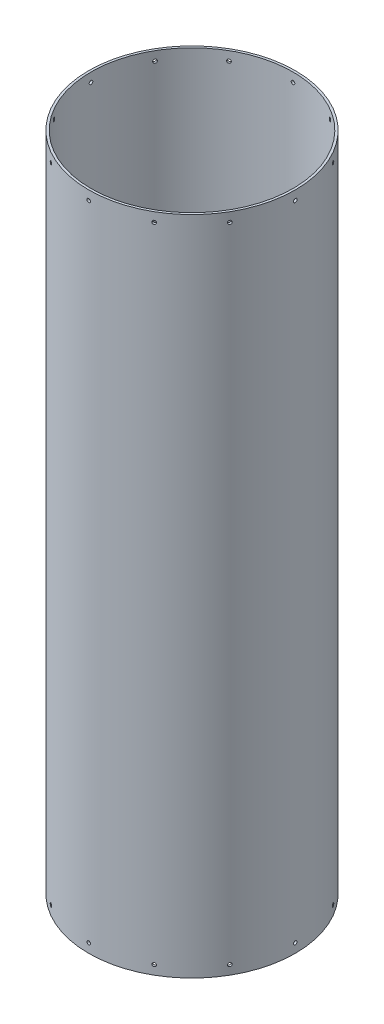
from build123d import *

# Parameters (mm, degrees)
SKETCH1_R                         = 142.875
SKETCH1_R_2                       = 139.7
BOSS_EXTRUDE1_DEPTH               = 914.4
F_10_0_1935_DIAMETER_HOLE1_REACH  = 970.604
F_10_0_1935_DIAMETER_HOLE1_BORE_R = 2.45745
CIRPATTERN1_COUNT                 = 12
MIRROR1_COPY_1_REACH              = 970.604
MIRROR1_COPY_1_SKETCH_R           = 2.45745
MIRROR1_COPY_2_REACH              = 970.604
MIRROR1_COPY_2_SKETCH_R           = 2.45745
MIRROR1_COPY_3_REACH              = 970.604
MIRROR1_COPY_3_SKETCH_R           = 2.45745
MIRROR1_COPY_4_REACH              = 970.604
MIRROR1_COPY_4_SKETCH_R           = 2.45745
MIRROR1_COPY_5_REACH              = 970.604
MIRROR1_COPY_5_SKETCH_R           = 2.45745
MIRROR1_COPY_6_REACH              = 970.604
MIRROR1_COPY_6_SKETCH_R           = 2.45745
MIRROR1_COPY_7_REACH              = 970.604
MIRROR1_COPY_7_SKETCH_R           = 2.45745
MIRROR1_COPY_8_REACH              = 970.604
MIRROR1_COPY_8_SKETCH_R           = 2.45745
MIRROR1_COPY_9_REACH              = 970.604
MIRROR1_COPY_9_SKETCH_R           = 2.45745
MIRROR1_COPY_10_REACH             = 970.604
MIRROR1_COPY_10_SKETCH_R          = 2.45745
MIRROR1_COPY_11_REACH             = 970.604
MIRROR1_COPY_11_SKETCH_R          = 2.45745


with BuildPart() as part:
    # Sketch1 → Boss-Extrude1 (new body)
    with BuildSketch(Plane(origin=(0, 0, 0), x_dir=(1, 0, 0), z_dir=(0, 1, 0))):
        with Locations(Location((0, 0, 0), (0, 0, 270))):
            Circle(SKETCH1_R)
        with Locations(Location((0, 0, 0), (0, 0, 270))):
            Circle(SKETCH1_R_2, mode=Mode.SUBTRACT)
    extrude(amount=BOSS_EXTRUDE1_DEPTH)

    # #10 (0.1935) Diameter Hole1 bore → #10 (0.1935) Diameter Hole1 (cut, up to next)
    with BuildSketch(Plane(origin=(142.875, 0, 0), x_dir=(0, 0, -1), z_dir=(1, 0, 0)), mode=Mode.PRIVATE) as f_10_0_1935_diameter_hole1_sk1:
        with Locations((0, 901.7)):
            Circle(F_10_0_1935_DIAMETER_HOLE1_BORE_R)
    f_10_0_1935_diameter_hole1_tool1 = extrude(f_10_0_1935_diameter_hole1_sk1.sketch, amount=-F_10_0_1935_DIAMETER_HOLE1_REACH, mode=Mode.PRIVATE) & part.part
    f_10_0_1935_diameter_hole1 = f_10_0_1935_diameter_hole1_tool1.solids().sort_by_distance((142.875, 901.7, 0))[0]
    add(f_10_0_1935_diameter_hole1, mode=Mode.SUBTRACT)

    # CirPattern1: #10 (0.1935) Diameter Hole1 ×12 about axis
    cirpattern1_axis = Axis((0, 914.4, 0), (0, 1, 0))
    for i in range(1, CIRPATTERN1_COUNT):
        add(f_10_0_1935_diameter_hole1.rotate(cirpattern1_axis, i * 360 / CIRPATTERN1_COUNT), mode=Mode.SUBTRACT)

    # Mirror1: #10 (0.1935) Diameter Hole1 across plane
    add(f_10_0_1935_diameter_hole1.mirror(Plane.ZX.offset(457.2)), mode=Mode.SUBTRACT)

    # Mirror1 copy 1 sketch → Mirror1 copy 1 (cut, up to next)
    with BuildSketch(Plane(origin=(123.733379566, 914.4, -71.4375), x_dir=(-0.49999999999999994, 0, -0.8660254037844387), z_dir=(0.8660254037844387, 0, -0.49999999999999994)), mode=Mode.PRIVATE) as mirror1_copy_1_sk1:
        with Locations((0, -901.7)):
            Circle(MIRROR1_COPY_1_SKETCH_R)
    mirror1_copy_1_tool1 = extrude(mirror1_copy_1_sk1.sketch, amount=-MIRROR1_COPY_1_REACH, mode=Mode.PRIVATE) & part.part
    add(mirror1_copy_1_tool1.solids().sort_by_distance((123.733379566, 12.7, -71.4375))[0], mode=Mode.SUBTRACT)

    # Mirror1 copy 2 sketch → Mirror1 copy 2 (cut, up to next)
    with BuildSketch(Plane(origin=(71.4375, 914.4, -123.733379566), x_dir=(-0.8660254037844386, 0, -0.5000000000000001), z_dir=(0.5000000000000001, 0, -0.8660254037844386)), mode=Mode.PRIVATE) as mirror1_copy_2_sk1:
        with Locations((0, -901.7)):
            Circle(MIRROR1_COPY_2_SKETCH_R)
    mirror1_copy_2_tool1 = extrude(mirror1_copy_2_sk1.sketch, amount=-MIRROR1_COPY_2_REACH, mode=Mode.PRIVATE) & part.part
    add(mirror1_copy_2_tool1.solids().sort_by_distance((71.4375, 12.7, -123.733379566))[0], mode=Mode.SUBTRACT)

    # Mirror1 copy 3 sketch → Mirror1 copy 3 (cut, up to next)
    with BuildSketch(Plane(origin=(0, 914.4, -142.875), x_dir=(-1, 0, 0), z_dir=(0, 0, -1)), mode=Mode.PRIVATE) as mirror1_copy_3_sk1:
        with Locations((0, -901.7)):
            Circle(MIRROR1_COPY_3_SKETCH_R)
    mirror1_copy_3_tool1 = extrude(mirror1_copy_3_sk1.sketch, amount=-MIRROR1_COPY_3_REACH, mode=Mode.PRIVATE) & part.part
    add(mirror1_copy_3_tool1.solids().sort_by_distance((0, 12.7, -142.875))[0], mode=Mode.SUBTRACT)

    # Mirror1 copy 4 sketch → Mirror1 copy 4 (cut, up to next)
    with BuildSketch(Plane(origin=(-71.4375, 914.4, -123.733379566), x_dir=(-0.8660254037844387, 0, 0.4999999999999998), z_dir=(-0.4999999999999998, 0, -0.8660254037844387)), mode=Mode.PRIVATE) as mirror1_copy_4_sk1:
        with Locations((0, -901.7)):
            Circle(MIRROR1_COPY_4_SKETCH_R)
    mirror1_copy_4_tool1 = extrude(mirror1_copy_4_sk1.sketch, amount=-MIRROR1_COPY_4_REACH, mode=Mode.PRIVATE) & part.part
    add(mirror1_copy_4_tool1.solids().sort_by_distance((-71.4375, 12.7, -123.733379566))[0], mode=Mode.SUBTRACT)

    # Mirror1 copy 5 sketch → Mirror1 copy 5 (cut, up to next)
    with BuildSketch(Plane(origin=(-123.733379566, 914.4, -71.4375), x_dir=(-0.49999999999999994, 0, 0.8660254037844387), z_dir=(-0.8660254037844387, 0, -0.49999999999999994)), mode=Mode.PRIVATE) as mirror1_copy_5_sk1:
        with Locations((0, -901.7)):
            Circle(MIRROR1_COPY_5_SKETCH_R)
    mirror1_copy_5_tool1 = extrude(mirror1_copy_5_sk1.sketch, amount=-MIRROR1_COPY_5_REACH, mode=Mode.PRIVATE) & part.part
    add(mirror1_copy_5_tool1.solids().sort_by_distance((-123.733379566, 12.7, -71.4375))[0], mode=Mode.SUBTRACT)

    # Mirror1 copy 6 sketch → Mirror1 copy 6 (cut, up to next)
    with BuildSketch(Plane(origin=(-142.875, 914.4, 0), x_dir=(0, 0, 1), z_dir=(-1, 0, 0)), mode=Mode.PRIVATE) as mirror1_copy_6_sk1:
        with Locations((0, -901.7)):
            Circle(MIRROR1_COPY_6_SKETCH_R)
    mirror1_copy_6_tool1 = extrude(mirror1_copy_6_sk1.sketch, amount=-MIRROR1_COPY_6_REACH, mode=Mode.PRIVATE) & part.part
    add(mirror1_copy_6_tool1.solids().sort_by_distance((-142.875, 12.7, 0))[0], mode=Mode.SUBTRACT)

    # Mirror1 copy 7 sketch → Mirror1 copy 7 (cut, up to next)
    with BuildSketch(Plane(origin=(-123.733379566, 914.4, 71.4375), x_dir=(0.5000000000000001, 0, 0.8660254037844386), z_dir=(-0.8660254037844386, 0, 0.5000000000000001)), mode=Mode.PRIVATE) as mirror1_copy_7_sk1:
        with Locations((0, -901.7)):
            Circle(MIRROR1_COPY_7_SKETCH_R)
    mirror1_copy_7_tool1 = extrude(mirror1_copy_7_sk1.sketch, amount=-MIRROR1_COPY_7_REACH, mode=Mode.PRIVATE) & part.part
    add(mirror1_copy_7_tool1.solids().sort_by_distance((-123.733379566, 12.7, 71.4375))[0], mode=Mode.SUBTRACT)

    # Mirror1 copy 8 sketch → Mirror1 copy 8 (cut, up to next)
    with BuildSketch(Plane(origin=(-71.4375, 914.4, 123.733379566), x_dir=(0.8660254037844384, 0, 0.5000000000000004), z_dir=(-0.5000000000000004, 0, 0.8660254037844384)), mode=Mode.PRIVATE) as mirror1_copy_8_sk1:
        with Locations((0, -901.7)):
            Circle(MIRROR1_COPY_8_SKETCH_R)
    mirror1_copy_8_tool1 = extrude(mirror1_copy_8_sk1.sketch, amount=-MIRROR1_COPY_8_REACH, mode=Mode.PRIVATE) & part.part
    add(mirror1_copy_8_tool1.solids().sort_by_distance((-71.4375, 12.7, 123.733379566))[0], mode=Mode.SUBTRACT)

    # Mirror1 copy 9 sketch → Mirror1 copy 9 (cut, up to next)
    with BuildSketch(Plane(origin=(0, 914.4, 142.875), x_dir=(1, 0, 0), z_dir=(0, 0, 1)), mode=Mode.PRIVATE) as mirror1_copy_9_sk1:
        with Locations((0, -901.7)):
            Circle(MIRROR1_COPY_9_SKETCH_R)
    mirror1_copy_9_tool1 = extrude(mirror1_copy_9_sk1.sketch, amount=-MIRROR1_COPY_9_REACH, mode=Mode.PRIVATE) & part.part
    add(mirror1_copy_9_tool1.solids().sort_by_distance((0, 12.7, 142.875))[0], mode=Mode.SUBTRACT)

    # Mirror1 copy 10 sketch → Mirror1 copy 10 (cut, up to next)
    with BuildSketch(Plane(origin=(71.4375, 914.4, 123.733379566), x_dir=(0.8660254037844386, 0, -0.5000000000000001), z_dir=(0.5000000000000001, 0, 0.8660254037844386)), mode=Mode.PRIVATE) as mirror1_copy_10_sk1:
        with Locations((0, -901.7)):
            Circle(MIRROR1_COPY_10_SKETCH_R)
    mirror1_copy_10_tool1 = extrude(mirror1_copy_10_sk1.sketch, amount=-MIRROR1_COPY_10_REACH, mode=Mode.PRIVATE) & part.part
    add(mirror1_copy_10_tool1.solids().sort_by_distance((71.4375, 12.7, 123.733379566))[0], mode=Mode.SUBTRACT)

    # Mirror1 copy 11 sketch → Mirror1 copy 11 (cut, up to next)
    with BuildSketch(Plane(origin=(123.733379566, 914.4, 71.4375), x_dir=(0.5000000000000004, 0, -0.8660254037844384), z_dir=(0.8660254037844384, 0, 0.5000000000000004)), mode=Mode.PRIVATE) as mirror1_copy_11_sk1:
        with Locations((0, -901.7)):
            Circle(MIRROR1_COPY_11_SKETCH_R)
    mirror1_copy_11_tool1 = extrude(mirror1_copy_11_sk1.sketch, amount=-MIRROR1_COPY_11_REACH, mode=Mode.PRIVATE) & part.part
    add(mirror1_copy_11_tool1.solids().sort_by_distance((123.733379566, 12.7, 71.4375))[0], mode=Mode.SUBTRACT)


solid = part.part
